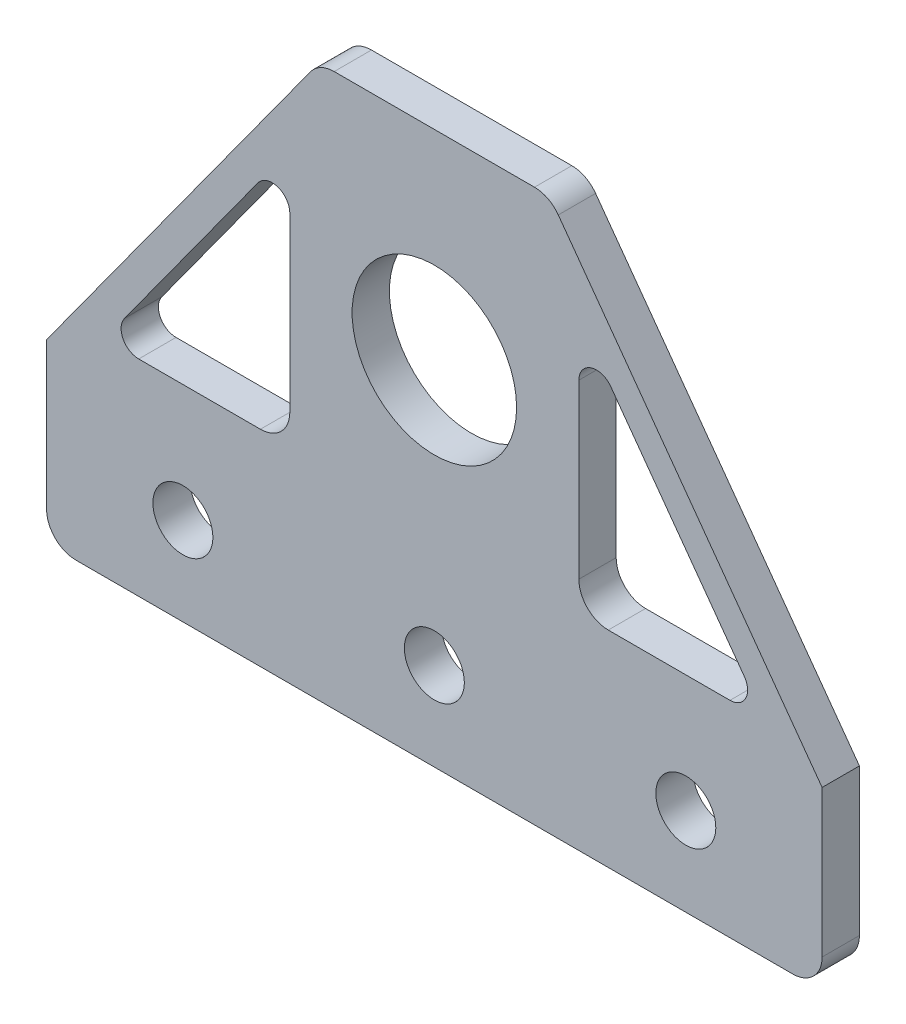
from build123d import *

# Parameters (mm, degrees)
SKETCH1_W           = 19.6
SKETCH1_H           = 47
SKETCH1_R           = 2.5527
SKETCH1_R_2         = 7
BOSS_EXTRUDE1_DEPTH = 3.175
SKETCH2_W           = 23.2
SKETCH2_H           = 15
SKETCH2_R           = 2.5527
BOSS_EXTRUDE2_DEPTH = 3.175
BOSS_EXTRUDE3_DEPTH = 3.175
FILLET1_R           = 2.5
FILLET2_R           = 1.5
FILLET3_R           = 2.5


with BuildPart() as part:
    # Sketch1 → Boss-Extrude1 (new body)
    with BuildSketch(Plane.XY):
        with Locations((0, 33.5)):
            Rectangle(SKETCH1_W, SKETCH1_H)
        with Locations((0, 17.5)):
            Circle(SKETCH1_R, mode=Mode.SUBTRACT)
        with Locations((0, 40)):
            Circle(SKETCH1_R_2, mode=Mode.SUBTRACT)
    extrude(amount=BOSS_EXTRUDE1_DEPTH)

    # Sketch2 → Boss-Extrude2 (add)
    # profile 1 of 2: a face of its own
    with BuildSketch(Plane.XY.offset(3.175)):
        with Locations((21.4, 17.5)):
            Rectangle(SKETCH2_W, SKETCH2_H)
        with Locations((21.4, 17.5)):
            Circle(SKETCH2_R, mode=Mode.SUBTRACT)
    # profile 2 of 2: a face of its own
    with BuildSketch(Plane.XY.offset(3.175)):
        with Locations((-21.4, 17.5)):
            Rectangle(SKETCH2_W, SKETCH2_H)
        with Locations((-21.4, 17.5)):
            Circle(SKETCH2_R, mode=Mode.SUBTRACT)
    extrude(amount=-BOSS_EXTRUDE2_DEPTH)

    # Sketch3 → Boss-Extrude3 (add)
    # profile 1 of 2: a face of its own
    with BuildSketch(Plane(origin=(0, 0, 0), x_dir=(-1, 0, 0), z_dir=(0, 0, -1))):
        Polygon((33, 25), (9.8, 57), (9.8, 25), align=None)
        Polygon((28.099595168, 27.5), (12.3, 49.29254506), (12.3, 27.5), align=None, mode=Mode.SUBTRACT)
    # profile 2 of 2: a face of its own
    with BuildSketch(Plane(origin=(0, 0, 0), x_dir=(-1, 0, 0), z_dir=(0, 0, -1))):
        Polygon((-9.8, 57), (-33, 25), (-9.8, 25), align=None)
        Polygon((-12.3, 49.29254506), (-28.099595168, 27.5), (-12.3, 27.5), align=None, mode=Mode.SUBTRACT)
    extrude(amount=-BOSS_EXTRUDE3_DEPTH)

    # Fillet1
    fillet1_edges = [part.edges().sort_by_distance(p)[0] for p in [
        (-12.3, 27.5, 1.5875),
        (12.3, 27.5, 1.5875),
    ]]
    fillet(fillet1_edges, radius=FILLET1_R)

    # Fillet2
    fillet2_edges = [part.edges().sort_by_distance(p)[0] for p in [
        (-12.3, 49.29254506, 1.5875),
        (-28.099595168, 27.5, 1.5875),
        (28.099595168, 27.5, 1.5875),
        (12.3, 49.29254506, 1.5875),
    ]]
    fillet(fillet2_edges, radius=FILLET2_R)

    # Fillet3
    fillet3_edges = [part.edges().sort_by_distance(p)[0] for p in [
        (-9.8, 57, 1.5875),
        (9.8, 57, 1.5875),
        (33, 10, 1.5875),
        (-33, 10, 1.5875),
    ]]
    fillet(fillet3_edges, radius=FILLET3_R)


solid = part.part
